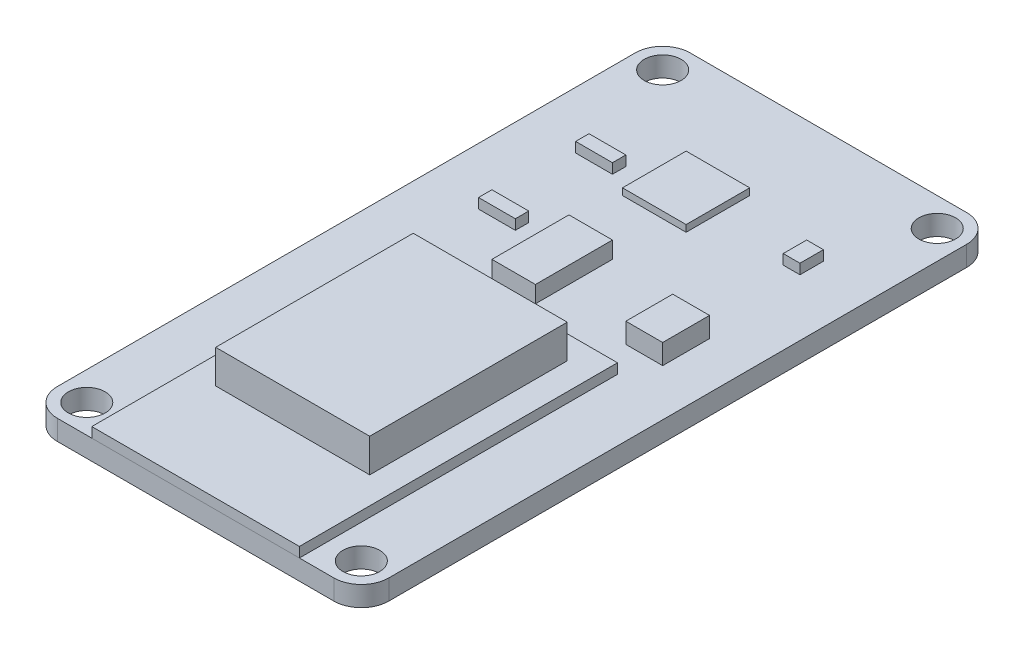
from build123d import *

# Parameters (mm, degrees)
SKETCH1_W           = 25.146
SKETCH1_H           = 48.006
BOSS_EXTRUDE1_DEPTH = 1.524
SKETCH3_W           = 15.748
SKETCH3_H           = 24.13
BOSS_EXTRUDE3_DEPTH = 0.762
SKETCH2_W           = 11.684
SKETCH2_H           = 14.986
BOSS_EXTRUDE2_DEPTH = 2.54
SKETCH6_R           = 1.397
CUT_EXTRUDE1_DEPTH  = 28.297024417
FILLET1_R           = 2.0828
SKETCH7_W           = 3.302
SKETCH7_H           = 5.842
BOSS_EXTRUDE4_DEPTH = 1.27
SKETCH8_W           = 4.826
SKETCH8_H           = 4.826
BOSS_EXTRUDE5_DEPTH = 0.508
SKETCH9_W           = 2.794
SKETCH9_H           = 3.556
BOSS_EXTRUDE6_DEPTH = 1.524
SKETCH10_W          = 2.794
SKETCH10_H          = 1.016
SKETCH10_W_2        = 1.27
SKETCH10_H_2        = 1.778
BOSS_EXTRUDE7_DEPTH = 0.762


with BuildPart() as part:
    # Sketch1 → Boss-Extrude1 (new body)
    with BuildSketch(Plane(origin=(0, 0, 0), x_dir=(1, 0, 0), z_dir=(0, 1, 0))):
        Rectangle(SKETCH1_W, SKETCH1_H)
    extrude(amount=BOSS_EXTRUDE1_DEPTH)

    # Sketch6 → Cut-Extrude1 (cut, through all)
    with BuildSketch(Plane(origin=(0, 1.524, 0), x_dir=(1, 0, 0), z_dir=(0, 1, 0))):
        with Locations(Location((10.414, 21.844, 0), (0, 0, 270))):
            Circle(SKETCH6_R)
        with Locations(Location((-10.414, 21.844, 0), (0, 0, 270))):
            Circle(SKETCH6_R)
        with Locations(Location((-10.414, -21.844, 0), (0, 0, 270))):
            Circle(SKETCH6_R)
        with Locations(Location((10.414, -21.844, 0), (0, 0, 270))):
            Circle(SKETCH6_R)
    extrude(amount=-CUT_EXTRUDE1_DEPTH, mode=Mode.SUBTRACT)

    # Fillet1
    fillet1_edges = [part.edges().sort_by_distance(p)[0] for p in [
        (12.573, 0.762, 24.003),
        (-12.573, 0.762, 24.003),
        (-12.573, 0.762, -24.003),
        (12.573, 0.762, -24.003),
    ]]
    fillet(fillet1_edges, radius=FILLET1_R)

    # Sketch7 → Boss-Extrude4 (add)
    with BuildSketch(Plane(origin=(0, 1.524, 0), x_dir=(1, 0, 0), z_dir=(0, 1, 0))):
        with Locations((-1.524, 4.572)):
            Rectangle(SKETCH7_W, SKETCH7_H)
    extrude(amount=BOSS_EXTRUDE4_DEPTH)

    # Sketch8 → Boss-Extrude5 (add)
    with BuildSketch(Plane(origin=(0, 1.524, 0), x_dir=(1, 0, 0), z_dir=(0, 1, 0))):
        with Locations((-1.27, 14.478)):
            Rectangle(SKETCH8_W, SKETCH8_H)
    extrude(amount=BOSS_EXTRUDE5_DEPTH)

    # Sketch9 → Boss-Extrude6 (add)
    with BuildSketch(Plane(origin=(0, 1.524, 0), x_dir=(1, 0, 0), z_dir=(0, 1, 0))):
        with Locations((7.62, 4.191)):
            Rectangle(SKETCH9_W, SKETCH9_H)
    extrude(amount=BOSS_EXTRUDE6_DEPTH)

    # Sketch10 → Boss-Extrude7 (add)
    with BuildSketch(Plane(origin=(0, 1.524, 0), x_dir=(1, 0, 0), z_dir=(0, 1, 0))):
        with Locations((-6.858, 6.223)):
            Rectangle(SKETCH10_W, SKETCH10_H)
        with Locations((-6.858, 13.589)):
            Rectangle(SKETCH10_W, SKETCH10_H)
        with Locations((7.62, 14.478)):
            Rectangle(SKETCH10_W_2, SKETCH10_H_2)
    extrude(amount=BOSS_EXTRUDE7_DEPTH)


with BuildPart() as body_2:
    # Sketch3 → Boss-Extrude3 (new body)
    with BuildSketch(Plane(origin=(0, 1.524, 0), x_dir=(1, 0, 0), z_dir=(0, 1, 0))):
        with Locations((0, -11.938)):
            Rectangle(SKETCH3_W, SKETCH3_H)
    extrude(amount=BOSS_EXTRUDE3_DEPTH)


with BuildPart() as body_3:
    # Sketch2 → Boss-Extrude2 (new body)
    with BuildSketch(Plane(origin=(0, 2.286, 0), x_dir=(1, 0, 0), z_dir=(0, 1, 0))):
        with Locations((0, -9.144)):
            Rectangle(SKETCH2_W, SKETCH2_H)
    extrude(amount=BOSS_EXTRUDE2_DEPTH)


solid = Compound([part.part, body_2.part, body_3.part])
